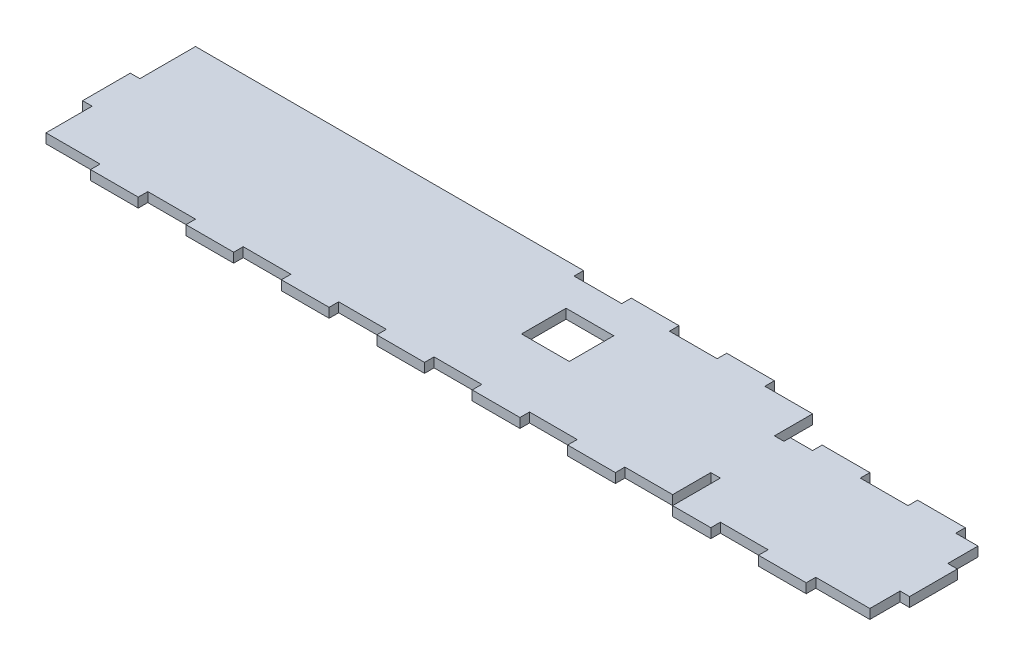
from build123d import *

# Parameters (mm, degrees)
SALIENTE_EXTRUIR1_DEPTH = 3
SKETCH1_W               = 15
SKETCH1_H               = 14
CUT_EXTRUDE1_DEPTH      = 10


with BuildPart() as part:
    # Croquis1 → Saliente-Extruir1 (new body)
    with BuildSketch(Plane(origin=(0, 0, 0), x_dir=(1, 0, 0), z_dir=(0, 1, 0))):
        Polygon((125, 47), (125, 50), (3, 50), (3, 32.5), (0, 32.5), (0, 17.5), (3, 17.5), (3, 3), (20, 3), (20, 0), (35, 0), (35, 3), (50, 3), (50, 0), (65, 0), (65, 3), (80, 3), (80, 0), (95, 0), (95, 3), (110, 3), (110, 0), (125, 0), (125, 3), (140, 3), (140, 0), (155, 0), (155, 3), (170, 3), (170, 0), (185, 0), (185, 3), (200, 3), (200, 15), (203, 15), (203, 0), (215, 0), (215, 3), (230, 3), (230, 0), (245, 0), (245, 3), (262, 3), (262, 12.5), (265, 12.5), (265, 27.5), (262, 27.5), (262, 37), (255, 37), (255, 40), (240, 40), (240, 37), (225, 37), (225, 40), (210, 40), (210, 37), (203, 37), (203, 35), (200, 35), (200, 47), (185, 47), (185, 50), (170, 50), (170, 47), (155, 47), (155, 50), (140, 50), (140, 47), align=None)
    extrude(amount=SALIENTE_EXTRUIR1_DEPTH)

    # Sketch1 → Cut-Extrude1 (cut)
    with BuildSketch(Plane(origin=(0, 3, 0), x_dir=(1, 0, 0), z_dir=(0, 1, 0))):
        with Locations((140, 30)):
            Rectangle(SKETCH1_W, SKETCH1_H)
    extrude(amount=-CUT_EXTRUDE1_DEPTH, mode=Mode.SUBTRACT)


solid = part.part
